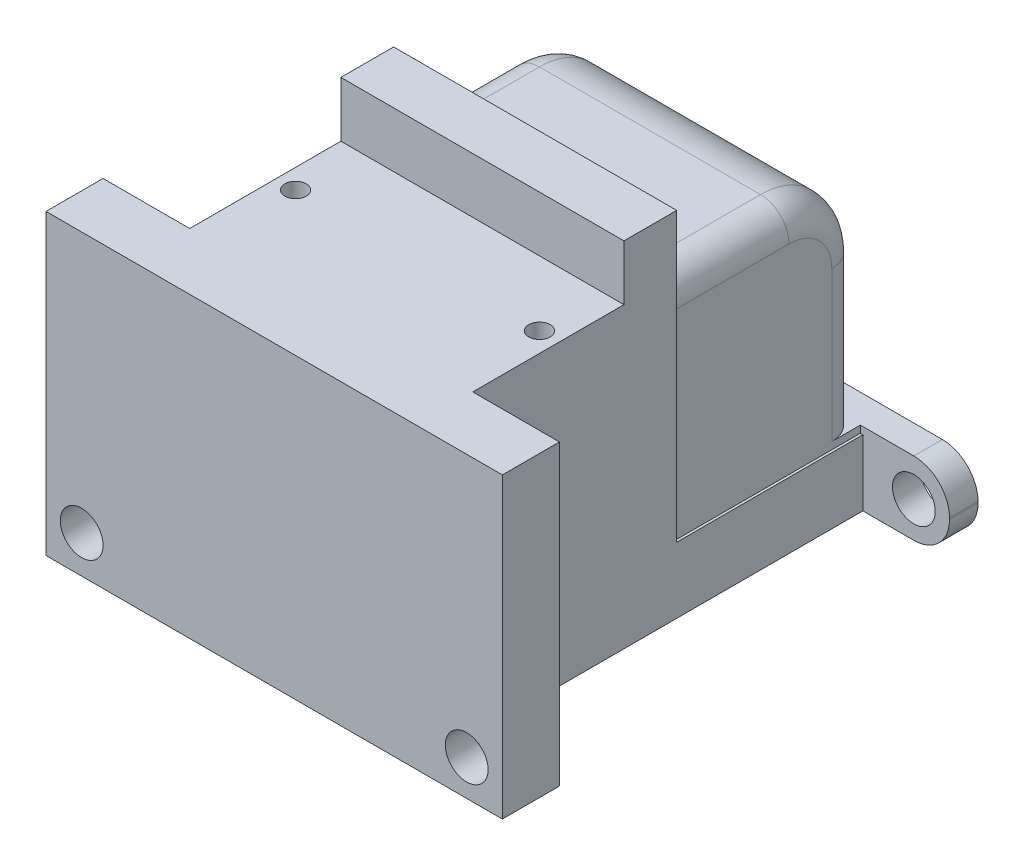
from build123d import *

# Parameters (mm, degrees)
RESSALTO_EXTRUS_O1_DEPTH = 49.55
ESBO_O2_W                = 39
ESBO_O2_H                = 26.1
CORTE_EXTRUS_O1_DEPTH    = 8.3
ESBO_O2_3_W              = 0.35
ESBO_O2_3_H              = 26.1
CORTE_EXTRUS_O2_DEPTH    = 40.3
ESBO_O3_W                = 64
ESBO_O3_H                = 4
CORTE_EXTRUS_O3_DEPTH    = 39.3
FILETE2_R                = 5
FILETE3_R                = 10
ESBO_O4_R                = 3
CORTE_EXTRUS_O4_DEPTH    = 90.03983659
CORTE_EXTRUS_O5_DEPTH    = 7.75
ESBO_O6_R                = 1.5
CORTE_EXTRUS_O6_DEPTH    = 10
FILETE4_R                = 4


with BuildPart() as part:
    # Esboço1 → Ressalto-extrusão1 (new body)
    with BuildSketch(Plane(origin=(0, 0, 0), x_dir=(1, 0, 0), z_dir=(0, 1, 0))):
        Polygon((-32, 33.35), (-32, 29.35), (-19.85, 29.35), (-19.85, -25.35), (-32, -25.35), (-32, -33.35), (32, -33.35), (32, -25.35), (19.85, -25.35), (19.85, 29.35), (32, 29.35), (32, 33.35), align=None)
    extrude(amount=RESSALTO_EXTRUS_O1_DEPTH)

    # Esboço2 → Corte-extrusão1 (cut)
    with BuildSketch(Plane(origin=(0, 49.55, 0), x_dir=(1, 0, 0), z_dir=(0, 1, 0))):
        with Locations((0, 16.3)):
            Rectangle(ESBO_O2_W, ESBO_O2_H)
    extrude(amount=-CORTE_EXTRUS_O1_DEPTH, mode=Mode.SUBTRACT)

    # Esboço2<3> → Corte-extrusão2 (cut)
    with BuildSketch(Plane(origin=(0, 49.55, 0), x_dir=(1, 0, 0), z_dir=(0, 1, 0))):
        with Locations((19.675, 16.3)):
            Rectangle(ESBO_O2_3_W, ESBO_O2_3_H)
        with Locations((-19.675, 16.3)):
            Rectangle(ESBO_O2_3_W, ESBO_O2_3_H)
    extrude(amount=-CORTE_EXTRUS_O2_DEPTH, mode=Mode.SUBTRACT)

    # Esboço3 → Corte-extrusão3 (cut)
    with BuildSketch(Plane(origin=(0, 49.55, 0), x_dir=(1, 0, 0), z_dir=(0, 1, 0))):
        with Locations((0, 31.35)):
            Rectangle(ESBO_O3_W, ESBO_O3_H)
    extrude(amount=-CORTE_EXTRUS_O3_DEPTH, mode=Mode.SUBTRACT)

    # Filete2
    filete2_edges = [part.edges().sort_by_distance(p)[0] for p in [
        (-32, 0, -31.35),
        (-32, 10.25, -31.35),
        (32, 0, -31.35),
        (32, 10.25, -31.35),
    ]]
    fillet(filete2_edges, radius=FILETE2_R)

    # Filete3
    filete3_edges = [part.edges().sort_by_distance(p)[0] for p in [
        (0, 41.25, -29.35),
    ]]
    fillet(filete3_edges, radius=FILETE3_R)

    # Esboço4 → Corte-extrusão4 (cut, through all)
    with BuildSketch(Plane(origin=(0, 0, -33.35), x_dir=(-1, 0, 0), z_dir=(0, 0, -1))):
        with Locations((27, 5.25)):
            Circle(ESBO_O4_R)
        with Locations((-27, 5)):
            Circle(ESBO_O4_R)
    extrude(amount=-CORTE_EXTRUS_O4_DEPTH, mode=Mode.SUBTRACT)

    # Esboço5 → Corte-extrusão5 (cut)
    with BuildSketch(Plane(origin=(0, 49.55, 0), x_dir=(1, 0, 0), z_dir=(0, 1, 0))):
        Polygon((-19.85, -4.15), (-19.85, -25.35), (-32, -25.35), (-32, -33.35), (32, -33.35), (32, -25.35), (19.85, -25.35), (19.85, -4.15), align=None)
    extrude(amount=-CORTE_EXTRUS_O5_DEPTH, mode=Mode.SUBTRACT)

    # Esboço6 → Corte-extrusão6 (cut)
    with BuildSketch(Plane(origin=(0, 41.8, 0), x_dir=(1, 0, 0), z_dir=(0, 1, 0))):
        with Locations((17.1, -13.25)):
            Circle(ESBO_O6_R)
        with Locations((-17.1, -13.25)):
            Circle(ESBO_O6_R)
    extrude(amount=-CORTE_EXTRUS_O6_DEPTH, mode=Mode.SUBTRACT)

    # Filete4
    filete4_edges = [part.edges().sort_by_distance(p)[0] for p in [
        (-19.5, 20.75, -29.35),
        (-19.5, 38.321067812, -26.421067812),
        (19.5, 20.75, -29.35),
        (19.5, 38.321067812, -26.421067812),
        (-19.5, 41.25, -11.3),
        (19.5, 41.25, -11.3),
    ]]
    fillet(filete4_edges, radius=FILETE4_R)


solid = part.part
